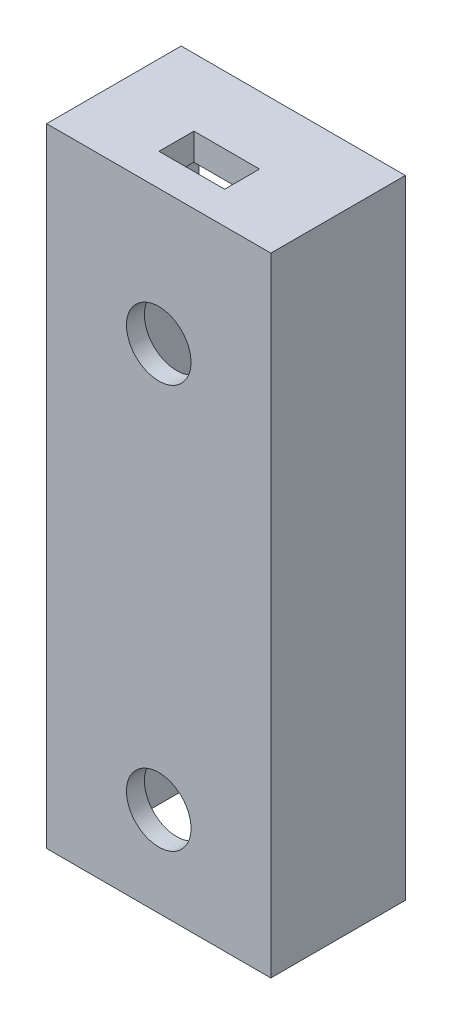
from build123d import *

# Parameters (mm, degrees)
SKETCH1_W           = 25
SKETCH1_H           = 70
BOSS_EXTRUDE1_DEPTH = 15
CUT_EXTRUDE1_REACH  = 74.672
SKETCH2_W           = 21
SKETCH2_H           = 13
SKETCH4_W           = 25
SKETCH4_H           = 15
SKETCH4_W_2         = 7.320869851
SKETCH4_H_2         = 3.892108022
BOSS_EXTRUDE2_DEPTH = 3
CUT_EXTRUDE3_REACH  = 41.373
SKETCH5_R           = 3.6


with BuildPart() as part:
    # Sketch1 → Boss-Extrude1 (new body)
    with BuildSketch(Plane.XY):
        Rectangle(SKETCH1_W, SKETCH1_H)
    extrude(amount=-BOSS_EXTRUDE1_DEPTH)

    # Sketch2 → Cut-Extrude1 (cut, up to next)
    with BuildSketch(Plane(origin=(0, 35, 0), x_dir=(1, 0, 0), z_dir=(0, 1, 0)), mode=Mode.PRIVATE) as cut_extrude1_sk1:
        with Locations((0, 8.5)):
            Rectangle(SKETCH2_W, SKETCH2_H)
    cut_extrude1_tool1 = extrude(cut_extrude1_sk1.sketch, amount=-CUT_EXTRUDE1_REACH, mode=Mode.PRIVATE) & part.part
    add(cut_extrude1_tool1.solids().sort_by_distance((0, 35, -8.5))[0], mode=Mode.SUBTRACT)

    # Sketch4 → Boss-Extrude2 (add)
    with BuildSketch(Plane(origin=(0, 35, 0), x_dir=(1, 0, 0), z_dir=(0, 1, 0))):
        with Locations((0, 7.5)):
            Rectangle(SKETCH4_W, SKETCH4_H)
        with Locations((0.092669239, 5.540570559)):
            Rectangle(SKETCH4_W_2, SKETCH4_H_2, mode=Mode.SUBTRACT)
    extrude(amount=-BOSS_EXTRUDE2_DEPTH)

    # Sketch5 → Cut-Extrude3 (cut, up to next)
    with BuildSketch(Plane(origin=(0, 0, -2), x_dir=(-1, 0, 0), z_dir=(0, 0, -1)), mode=Mode.PRIVATE) as cut_extrude3_sk1:
        with Locations((0, 20)):
            Circle(SKETCH5_R)
    cut_extrude3_tool1 = extrude(cut_extrude3_sk1.sketch, amount=-CUT_EXTRUDE3_REACH, mode=Mode.PRIVATE) & part.part
    # Sketch5 → Cut-Extrude3 (cut, up to next)
    with BuildSketch(Plane(origin=(0, 0, -2), x_dir=(-1, 0, 0), z_dir=(0, 0, -1)), mode=Mode.PRIVATE) as cut_extrude3_sk2:
        with Locations((0, -25)):
            Circle(SKETCH5_R)
    cut_extrude3_tool2 = extrude(cut_extrude3_sk2.sketch, amount=-CUT_EXTRUDE3_REACH, mode=Mode.PRIVATE) & part.part
    add(cut_extrude3_tool1.solids().sort_by_distance((0, 20, -2))[0], mode=Mode.SUBTRACT)
    add(cut_extrude3_tool2.solids().sort_by_distance((0, -25, -2))[0], mode=Mode.SUBTRACT)


solid = part.part
